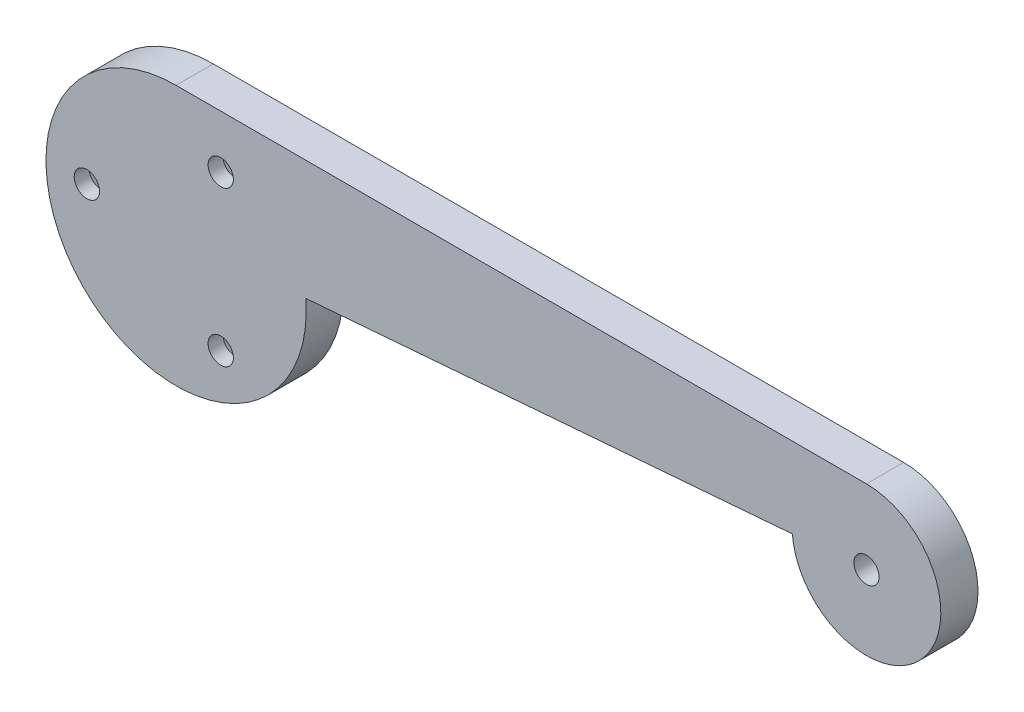
from build123d import *

# Parameters (mm, degrees)
BOSS_EXTRUDE1_DEPTH  = 5
M3_CLEARANCE_HOLE1_D = 3.4
CUT_EXTRUDE1_DEPTH   = 3
CIRPATTERN1_COUNT    = 3
M3_CLEARANCE_HOLE2_D = 3.4


with BuildPart() as part:
    # Sketch1 → Boss-Extrude1 (new body)
    with BuildSketch(Plane.XY):
        with BuildLine():
            Line((0, 17.5), (92.825687176, 17.5))
            ThreePointArc((92.825687176, 17.5), (100.175973433, 0.719639248), (82.858168684, 6.694658386))
            Line((82.858168684, 6.694658386), (17.443157361, 1.409347824))
            ThreePointArc((17.443157361, 1.409347824), (-11.865631317, -12.863000951), (0, 17.5))
        make_face()
    extrude(amount=BOSS_EXTRUDE1_DEPTH)

    # M3 Clearance Hole1 (through all)
    with Locations(Plane.XY.offset(5)):
        with Locations((-12, 0)):
            m3_clearance_hole1 = Hole(M3_CLEARANCE_HOLE1_D / 2)

    # Sketch8 → Cut-Extrude1 (cut)
    with BuildSketch(Plane.XY):
        Polygon((-10.383419246, 2.8), (-13.616580754, 2.8), (-15.233161507, 0), (-13.616580754, -2.8), (-10.383419246, -2.8), (-8.766838493, 0), align=None)
    cut_extrude1 = extrude(amount=CUT_EXTRUDE1_DEPTH, mode=Mode.SUBTRACT)

    # CirPattern1: M3 Clearance Hole1, Cut-Extrude1 ×3 about axis
    cirpattern1_axis = Axis((0, 0, 0), (0, 0, 1))
    add([m3_clearance_hole1.rotate(cirpattern1_axis, i * 360 / CIRPATTERN1_COUNT) for i in range(1, CIRPATTERN1_COUNT)], mode=Mode.SUBTRACT)
    add([cut_extrude1.rotate(cirpattern1_axis, i * 360 / CIRPATTERN1_COUNT) for i in range(1, CIRPATTERN1_COUNT)], mode=Mode.SUBTRACT)

    # M3 Clearance Hole2 (through all)
    with Locations(Plane.XY.offset(5)):
        with Locations((92.825687176, 7.5)):
            Hole(M3_CLEARANCE_HOLE2_D / 2)


solid = part.part
